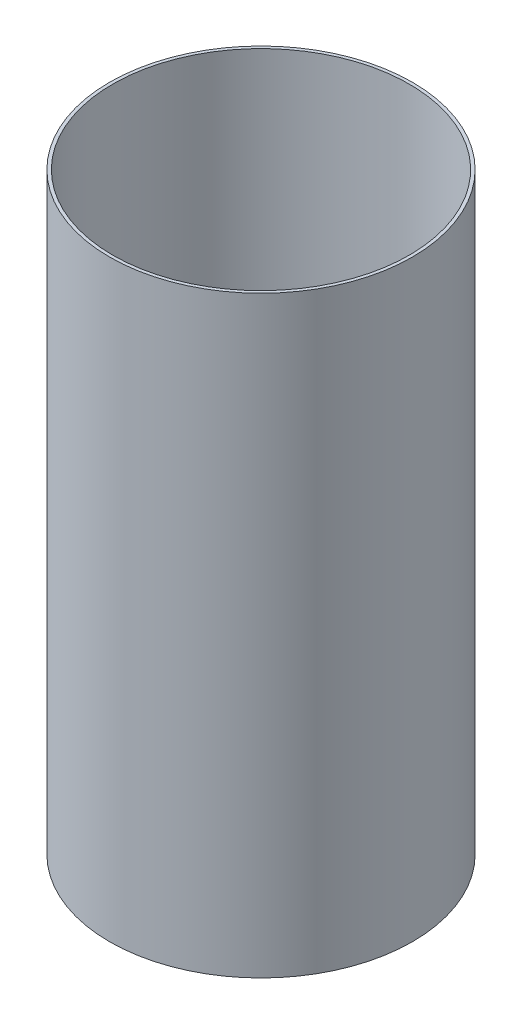
from build123d import *

# Parameters (mm, degrees)
SKETCH1_R           = 76.2
SKETCH1_R_2         = 74.6125
BOSS_EXTRUDE1_DEPTH = 149.225


with BuildPart() as part:
    # Sketch1 → Boss-Extrude1 (new, symmetric)
    with BuildSketch(Plane(origin=(0, 0, 0), x_dir=(1, 0, 0), z_dir=(0, 1, 0))):
        with Locations(Location((0, 0, 0), (0, 0, 270))):
            Circle(SKETCH1_R)
        with Locations(Location((0, 0, 0), (0, 0, 270))):
            Circle(SKETCH1_R_2, mode=Mode.SUBTRACT)
    extrude(amount=BOSS_EXTRUDE1_DEPTH, both=True)


solid = part.part
